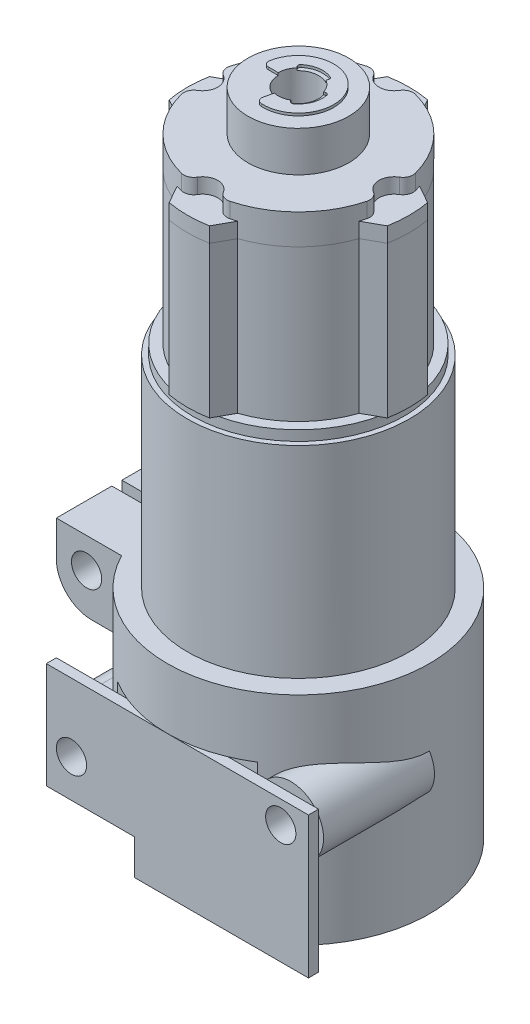
from build123d import *
from build123d.topology import SkipClean

# Parameters (mm, degrees)
CROQUIS1_R                         = 11
SALIENTE_EXTRUIR1_DEPTH            = 21
SALIENTE_EXTRUIR2_DEPTH            = 15
CORTAR_EXTRUIR1_START              = -1
CROQUIS4_R                         = 11
CROQUIS4_R_2                       = 10.5
CORTAR_EXTRUIR1_DEPTH              = 1
SALIENTE_EXTRUIR3_DEPTH            = 3
CORTAR_EXTRUIR2_DEPTH              = 1.5
CROQUIS7_R                         = 5
SALIENTE_EXTRUIR4_DEPTH            = 4
SALIENTE_EXTRUIR5_DEPTH            = 0.25
CROQUIS12_R                        = 13
SALIENTE_EXTRUIR7_DEPTH            = 21.5
CORTAR_EXTRUIR6_START              = -4.5
CORTAR_EXTRUIR6_DEPTH              = 4.5
CROQUIS15_R                        = 3.25
SALIENTE_EXTRUIR8_DEPTH            = 13
SALIENTE_EXTRUIR11_DEPTH           = 6
SALIENTE_EXTRUIR11_DEPTH_BACK      = 7.5
CROQUIS16_R                        = 1.5
CORTAR_EXTRUIR8_REACH              = 57.062
CORTAR_EXTRUIR8_END_RADIUS         = 11
CROQUIS9_R                         = 2
CORTAR_EXTRUIR5_DEPTH              = 69.214734592
CROQUIS20_W                        = 27.5
CROQUIS20_H                        = 15.5
CORTAR_EXTRUIR10_DEPTH             = 53.636133072
SALIENTE_EXTRUIR12_DEPTH           = 1
CORTAR_EXTRUIR11_DEPTH             = 8.5
CROQUIS23_R                        = 0.75
SALIENTE_EXTRUIR13_DEPTH           = 6
CORTAR_EXTRUIR12_REACH             = 50.616
CROQUIS24_W                        = 2.25
CROQUIS24_H                        = 3
CORTAR_EXTRUIR12_DIRECTION_2_REACH = 50.616
CROQUIS25_R                        = 1.5
CORTAR_EXTRUIR13_DEPTH             = 5


with BuildPart() as part:
    # Croquis1 → Saliente-Extruir1 (new body)
    with BuildSketch(Plane(origin=(0, 0, 0), x_dir=(1, 0, 0), z_dir=(0, 1, 0))):
        with Locations(Location((0, 0, 0), (0, 0, 90))):
            Circle(CROQUIS1_R)
    extrude(amount=SALIENTE_EXTRUIR1_DEPTH)

    # Croquis4 → Cortar-Extruir1 (cut)
    with BuildSketch(Plane(origin=(0, 21, 0), x_dir=(1, 0, 0), z_dir=(0, 1, 0)).offset(CORTAR_EXTRUIR1_START)):
        with Locations(Location((0, 0, 0), (0, 0, 90))):
            Circle(CROQUIS4_R)
        with Locations(Location((0, 0, 0), (0, 0, 270))):
            Circle(CROQUIS4_R_2, mode=Mode.SUBTRACT)
    extrude(amount=CORTAR_EXTRUIR1_DEPTH, mode=Mode.SUBTRACT)

    # Croquis12 → Saliente-Extruir7 (add)
    with BuildSketch(Plane.XZ):
        with Locations(Location((0, 0, 0), (0, 0, 270))):
            Circle(CROQUIS12_R)
    extrude(amount=SALIENTE_EXTRUIR7_DEPTH)

    # Croquis14 → Cortar-Extruir6 (cut)
    with BuildSketch(Plane.XZ.offset(21.5).offset(CORTAR_EXTRUIR6_START)):
        with BuildLine():
            ThreePointArc((-8.2e-08, -13), (-1.510225466, -12.911979672), (-3, -12.649110641))
            Line((-3, -12.649110641), (-3, -10.062305899))
            ThreePointArc((-3, -10.062305899), (9.459263182, -4.557668269), (6, 8.61684397))
            Line((6, 8.61684397), (6, 11.532562595))
            ThreePointArc((6, 11.532562595), (11.113055385, 6.745368782), (13, 0))
            Line((13, 0), (13, 13))
            Line((13, 13), (-13, 13))
            Line((-13, 13), (-13, -13))
            Line((-13, -13), (-8.2e-08, -13))
        make_face()
    extrude(amount=CORTAR_EXTRUIR6_DEPTH, mode=Mode.SUBTRACT)

    # Croquis15 → Saliente-Extruir8 (add, through all)
    with SkipClean():  # the faces are left unmerged after this step: merging them gives an invalid solid
        with BuildSketch(Plane.XY):
            with Locations(Location((10.25, -9.25, 0), (0, 0, 327.795772496))):
                Circle(CROQUIS15_R)
            with BuildLine():
                Line((-12, -10.5), (-3, -10.5))
                Line((-3, -10.5), (-3, -17))
                Line((-3, -17), (-14, -17))
                Line((-14, -17), (-14, -12.5))
                ThreePointArc((-14, -12.5), (-13.414213562, -11.085786438), (-12, -10.5))
            make_face()
        extrude(amount=SALIENTE_EXTRUIR8_DEPTH)

    # Croquis16 → Saliente-Extruir11 (add, two sides: drawn at the far end of the back side and taken through both)
    with SkipClean():  # the faces are left unmerged after this step: merging them gives an invalid solid
        with BuildSketch(Plane.XY.offset(-SALIENTE_EXTRUIR11_DEPTH_BACK)):
            with BuildLine():
                Line((-18, 0), (0, 0))
                Line((0, 0), (0, -7))
                Line((0, -7), (-14.5, -7))
                ThreePointArc((-14.5, -7), (-16.974873734, -5.974873734), (-18, -3.5))
                Line((-18, -3.5), (-18, 0))
            make_face()
            with Locations((-15, -3)):
                Circle(CROQUIS16_R, mode=Mode.SUBTRACT)
        extrude(amount=SALIENTE_EXTRUIR11_DEPTH + SALIENTE_EXTRUIR11_DEPTH_BACK)

    # Cortar-Extruir8: up to this cylinder (the profile starts outside it)
    with SkipClean():  # the faces are left unmerged after this step: merging them gives an invalid solid
        cortar_extruir8_end = Plane(origin=(0, -7.27151, 0), z_dir=(0, -1, 0)) * Cylinder(CORTAR_EXTRUIR8_END_RADIUS, 137.124, mode=Mode.PRIVATE)
        # Croquis19 → Cortar-Extruir8 (cut, up to the surface)
        with BuildSketch(Plane.ZY.offset(18), mode=Mode.PRIVATE) as cortar_extruir8_sk1:
            with BuildLine():
                Line((-0.5, 0), (0.5, 0))
                Line((0.5, 0), (0.5, -8))
                Line((0.5, -8), (3, -8))
                ThreePointArc((3, -8), (4, -9), (3, -10))
                Line((3, -10), (-3, -10))
                ThreePointArc((-3, -10), (-4, -9), (-3, -8))
                Line((-3, -8), (-0.5, -8))
                Line((-0.5, -8), (-0.5, 0))
            make_face()
        cortar_extruir8_tool1 = extrude(cortar_extruir8_sk1.sketch, amount=-CORTAR_EXTRUIR8_REACH, mode=Mode.PRIVATE) - cortar_extruir8_end
        add(cortar_extruir8_tool1.solids().sort_by_distance((-18, -7.27151, 0))[0], mode=Mode.SUBTRACT)


with BuildPart() as body_2:
    # Croquis2 → Saliente-Extruir2 (new body)
    with BuildSketch(Plane(origin=(0, 21, 0), x_dir=(1, 0, 0), z_dir=(0, 1, 0))):
        with BuildLine():
            Line((-2, 10.816653826), (-3, 9.013878189))
            ThreePointArc((-3, 9.013878189), (-6.717514421, 6.717514421), (-9.013878189, 3))
            Line((-9.013878189, 3), (-10.816653826, 2))
            ThreePointArc((-10.816653826, 2), (-11, 0), (-10.816653826, -2))
            Line((-10.816653826, -2), (-9.013878189, -3))
            ThreePointArc((-9.013878189, -3), (-6.717514421, -6.717514421), (-3, -9.013878189))
            Line((-3, -9.013878189), (-2, -10.816653826))
            ThreePointArc((-2, -10.816653826), (0, -11), (2, -10.816653826))
            Line((2, -10.816653826), (3, -9.013878189))
            ThreePointArc((3, -9.013878189), (6.717514421, -6.717514421), (9.013878189, -3))
            Line((9.013878189, -3), (10.816653826, -2))
            ThreePointArc((10.816653826, -2), (11, 0), (10.816653826, 2))
            Line((10.816653826, 2), (9.013878189, 3))
            ThreePointArc((9.013878189, 3), (6.717514421, 6.717514421), (3, 9.013878189))
            Line((3, 9.013878189), (2, 10.816653826))
            ThreePointArc((2, 10.816653826), (0, 11), (-2, 10.816653826))
        make_face()
    extrude(amount=SALIENTE_EXTRUIR2_DEPTH)


with BuildPart() as body_3:
    # Croquis5 → Saliente-Extruir3 (new body)
    with BuildSketch(Plane(origin=(0, 36, 0), x_dir=(1, 0, 0), z_dir=(0, 1, 0))):
        with BuildLine():
            Line((-2, 10.816653826), (-3, 9.013878189))
            ThreePointArc((-3, 9.013878189), (-6.717514421, 6.717514421), (-9.013878189, 3))
            Line((-9.013878189, 3), (-10.816653826, 2))
            ThreePointArc((-10.816653826, 2), (-11, 0), (-10.816653826, -2))
            Line((-10.816653826, -2), (-9.013878189, -3))
            ThreePointArc((-9.013878189, -3), (-6.717514421, -6.717514421), (-3, -9.013878189))
            Line((-3, -9.013878189), (-2, -10.816653826))
            ThreePointArc((-2, -10.816653826), (0, -11), (2, -10.816653826))
            Line((2, -10.816653826), (3, -9.013878189))
            ThreePointArc((3, -9.013878189), (6.717514421, -6.717514421), (9.013878189, -3))
            Line((9.013878189, -3), (10.816653826, -2))
            ThreePointArc((10.816653826, -2), (11, 0), (10.816653826, 2))
            Line((10.816653826, 2), (9.013878189, 3))
            ThreePointArc((9.013878189, 3), (6.717514421, 6.717514421), (3, 9.013878189))
            Line((3, 9.013878189), (2, 10.816653826))
            ThreePointArc((2, 10.816653826), (0, 11), (-2, 10.816653826))
        make_face()
    extrude(amount=SALIENTE_EXTRUIR3_DEPTH)

    # Croquis6 → Cortar-Extruir2 (cut)
    with BuildSketch(Plane(origin=(0, 39, 0), x_dir=(1, 0, 0), z_dir=(0, 1, 0))):
        with BuildLine():
            Line((-3, 9.013878189), (-3, 11))
            Line((-3, 11), (3, 11))
            Line((3, 11), (3, 9.013878189))
            ThreePointArc((3, 9.013878189), (2.702732204, 9.107427663), (2.402555949, 9.191176471))
            ThreePointArc((2.402555949, 9.191176471), (1.769780297, 9.148722029), (1.289793193, 8.734210526))
            ThreePointArc((1.289793193, 8.734210526), (0, 8), (-1.289793193, 8.734210526))
            ThreePointArc((-1.289793193, 8.734210526), (-1.769780297, 9.148722029), (-2.402555949, 9.191176471))
            ThreePointArc((-2.402555949, 9.191176471), (-2.702732204, 9.107427663), (-3, 9.013878189))
        make_face()
        with BuildLine():
            Line((-9.013878189, -3), (-11, -3))
            Line((-11, -3), (-11, 3))
            Line((-11, 3), (-9.013878189, 3))
            ThreePointArc((-9.013878189, 3), (-9.107427663, 2.702732204), (-9.191176471, 2.402555949))
            ThreePointArc((-9.191176471, 2.402555949), (-9.148722029, 1.769780297), (-8.734210526, 1.289793193))
            ThreePointArc((-8.734210526, 1.289793193), (-8, 0), (-8.734210526, -1.289793193))
            ThreePointArc((-8.734210526, -1.289793193), (-9.148722029, -1.769780297), (-9.191176471, -2.402555949))
            ThreePointArc((-9.191176471, -2.402555949), (-9.107427663, -2.702732204), (-9.013878189, -3))
        make_face()
        with BuildLine():
            Line((9.013878189, 3), (11, 3))
            Line((11, 3), (11, -3))
            Line((11, -3), (9.013878189, -3))
            ThreePointArc((9.013878189, -3), (9.107427663, -2.702732204), (9.191176471, -2.402555949))
            ThreePointArc((9.191176471, -2.402555949), (9.148722029, -1.769780297), (8.734210526, -1.289793193))
            ThreePointArc((8.734210526, -1.289793193), (8, 0), (8.734210526, 1.289793193))
            ThreePointArc((8.734210526, 1.289793193), (9.148722029, 1.769780297), (9.191176471, 2.402555949))
            ThreePointArc((9.191176471, 2.402555949), (9.107427663, 2.702732204), (9.013878189, 3))
        make_face()
        with BuildLine():
            Line((3, -9.013878189), (3, -11))
            Line((3, -11), (-3, -11))
            Line((-3, -11), (-3, -9.013878189))
            ThreePointArc((-3, -9.013878189), (-2.702732204, -9.107427663), (-2.402555949, -9.191176471))
            ThreePointArc((-2.402555949, -9.191176471), (-1.769780297, -9.148722029), (-1.289793193, -8.734210526))
            ThreePointArc((-1.289793193, -8.734210526), (0, -8), (1.289793193, -8.734210526))
            ThreePointArc((1.289793193, -8.734210526), (1.769780297, -9.148722029), (2.402555949, -9.191176471))
            ThreePointArc((2.402555949, -9.191176471), (2.702732204, -9.107427663), (3, -9.013878189))
        make_face()
    extrude(amount=-CORTAR_EXTRUIR2_DEPTH, mode=Mode.SUBTRACT)

    # Croquis7 → Saliente-Extruir4 (add)
    with BuildSketch(Plane(origin=(0, 39, 0), x_dir=(1, 0, 0), z_dir=(0, 1, 0))):
        with Locations(Location((0, 0, 0), (0, 0, 270))):
            Circle(CROQUIS7_R)
    extrude(amount=SALIENTE_EXTRUIR4_DEPTH)

    # Croquis8 → Saliente-Extruir5 (add)
    with BuildSketch(Plane(origin=(0, 43, 0), x_dir=(1, 0, 0), z_dir=(0, 1, 0))):
        with BuildLine():
            Line((-0.4375, -1.951561874), (-0.647071226, -2.886398938))
            ThreePointArc((-0.647071226, -2.886398938), (-0.557649237, -3.297805179), (-0.185710884, -3.495069594))
            ThreePointArc((-0.185710884, -3.495069594), (2.732186624, 2.1875), (-3.45104654, 0.583333333))
            ThreePointArc((-3.45104654, 0.583333333), (-3.339921199, 0.177251388), (-2.958039892, 0))
            Line((-2.958039892, 0), (-2, 0))
            ThreePointArc((-2, 0), (-1.863156505, 0.727081728), (-1.47135216, 1.354667051))
            Line((-1.47135216, 1.354667051), (-1.570974215, 1.446388611))
            ThreePointArc((-1.570974215, 1.446388611), (-1.651604687, 1.634558733), (-1.564622326, 1.819878286))
            ThreePointArc((-1.564622326, 1.819878286), (-0.362288406, 2.372498074), (0.95017839, 2.203896782))
            ThreePointArc((0.95017839, 2.203896782), (1.088504765, 2.052982629), (1.067707825, 1.849324201))
            Line((1.067707825, 1.849324201), (1, 1.732050808))
            ThreePointArc((1, 1.732050808), (1.5612495, 1.25), (1.90885216, 0.596894823))
            Line((1.90885216, 0.596894823), (2.038096389, 0.637309273))
            ThreePointArc((2.038096389, 0.637309273), (2.241371731, 0.61305225), (2.358371991, 0.445063539))
            ThreePointArc((2.358371991, 0.445063539), (2.235787805, -0.872498074), (1.433541406, -1.924827015))
            ThreePointArc((1.433541406, -1.924827015), (1.233682727, -1.969164093), (1.067707825, -1.849324201))
            Line((1.067707825, -1.849324201), (1, -1.732050808))
            ThreePointArc((1, -1.732050808), (0.301907005, -1.977081728), (-0.4375, -1.951561874))
        make_face()
    extrude(amount=SALIENTE_EXTRUIR5_DEPTH)


with BuildPart() as cortar_extruir5_tool:
    # Croquis9 → Cortar-Extruir5 (new, through all)
    with SkipClean():  # the faces are left unmerged after this step: merging them gives an invalid solid
        with BuildSketch(Plane(origin=(0, 43, 0), x_dir=(1, 0, 0), z_dir=(0, 1, 0))):
            with Locations(Location((0, 0, 0), (0, 0, 60))):
                Circle(CROQUIS9_R)
        extrude(amount=-CORTAR_EXTRUIR5_DEPTH)


with BuildPart() as part_1:
    with SkipClean():  # the faces are left unmerged after this step: merging them gives an invalid solid
        add(part.part)

        # Cortar-Extruir5: cut by cortar_extruir5_tool
        add(cortar_extruir5_tool.part, mode=Mode.SUBTRACT)

    # Croquis20 → Cortar-Extruir10 (cut, through all)
    with SkipClean():  # the faces are left unmerged after this step: merging them gives an invalid solid
        with BuildSketch(Plane.XY.offset(11)):
            with Locations((-0.25, -13.75)):
                Rectangle(CROQUIS20_W, CROQUIS20_H)
        extrude(amount=CORTAR_EXTRUIR10_DEPTH, mode=Mode.SUBTRACT)

    # Croquis21 → Saliente-Extruir12 (add)
    with SkipClean():  # the faces are left unmerged after this step: merging them gives an invalid solid
        with BuildSketch(Plane.XY.offset(11)):
            Polygon((-13, -7), (13, -7), (13, -21), (-4.25, -21), (-4.25, -17.5), (-13, -17.5), align=None)
        extrude(amount=SALIENTE_EXTRUIR12_DEPTH)

    # Croquis22 → Cortar-Extruir11 (cut)
    with SkipClean():  # the faces are left unmerged after this step: merging them gives an invalid solid
        with BuildSketch(Plane.XZ.offset(21.5)):
            with BuildLine():
                Line((6, 11), (-4.25, 11))
                Line((-4.25, 11), (-4.25, 9.601432185))
                ThreePointArc((-4.25, 9.601432185), (-1.003981319, -10.45189081), (6, 8.61684397))
                Line((6, 8.61684397), (6, 11))
            make_face()
        extrude(amount=-CORTAR_EXTRUIR11_DEPTH, mode=Mode.SUBTRACT)

    # Croquis23 → Saliente-Extruir13 (add)
    # profile 1 of 2: a face of its own
    with SkipClean():  # the faces are left unmerged after this step: merging them gives an invalid solid
        with BuildSketch(Plane.XZ.offset(14)):
            Polygon((-3.75, 7), (-2.75, 6), (0.25, 6), (0.25, 11), (-3.75, 11), align=None)
            with Locations(Location((-1.75, 10, 0), (0, 0, 270))):
                Circle(CROQUIS23_R, mode=Mode.SUBTRACT)
        # profile 2 of 2: a face of its own
        with BuildSketch(Plane.XZ.offset(14)):
            Polygon((1.5, 7), (2.5, 6), (5.5, 6), (5.5, 11), (1.5, 11), align=None)
            with Locations(Location((3.5, 10, 0), (0, 0, 270))):
                Circle(CROQUIS23_R, mode=Mode.SUBTRACT)
        extrude(amount=SALIENTE_EXTRUIR13_DEPTH)

    # Croquis24 → Cortar-Extruir12 (cut, up to next)
    with BuildSketch(Plane(origin=(0, 0, 0), x_dir=(0, 0, -1), z_dir=(1, 0, 0)), mode=Mode.PRIVATE) as cortar_extruir12_sk1:
        with Locations((-7.125, -17)):
            Rectangle(CROQUIS24_W, CROQUIS24_H)
    cortar_extruir12_tool1 = extrude(cortar_extruir12_sk1.sketch, amount=-CORTAR_EXTRUIR12_REACH, mode=Mode.PRIVATE) & part_1.part
    add(cortar_extruir12_tool1.solids().sort_by_distance((0, -17, 7.125))[0], mode=Mode.SUBTRACT)

    # Cortar-Extruir12 direction 2: up to this face of the body (flat: up to its plane)
    cortar_extruir12_direction_2_end = Plane(part_1.part.faces().sort_by_distance((5.5, -17, 8.5))[0])
    # Croquis24 → Cortar-Extruir12 direction 2 (cut, up to the picked face)
    with BuildSketch(Plane(origin=(0, 0, 0), x_dir=(0, 0, -1), z_dir=(1, 0, 0)), mode=Mode.PRIVATE) as cortar_extruir12_direction_2_sk1:
        with Locations((-7.125, -17)):
            Rectangle(CROQUIS24_W, CROQUIS24_H)
    cortar_extruir12_direction_2_tool1 = split(extrude(cortar_extruir12_direction_2_sk1.sketch, amount=CORTAR_EXTRUIR12_DIRECTION_2_REACH, mode=Mode.PRIVATE), bisect_by=cortar_extruir12_direction_2_end, keep=Keep.BOTH, mode=Mode.PRIVATE)
    add(cortar_extruir12_direction_2_tool1.solids().sort_by(Axis((0, -17, 7.125), (1, 0, 0)))[0], mode=Mode.SUBTRACT)

    # Croquis25 → Cortar-Extruir13 (cut)
    with SkipClean():  # the faces are left unmerged after this step: merging them gives an invalid solid
        with BuildSketch(Plane.XY.offset(12)):
            with Locations((10.25, -9.25)):
                Circle(CROQUIS25_R)
            with Locations((-10.5, -13.75)):
                Circle(CROQUIS25_R)
        extrude(amount=-CORTAR_EXTRUIR13_DEPTH, mode=Mode.SUBTRACT)


with BuildPart() as body_2_1:
    with SkipClean():  # the faces are left unmerged after this step: merging them gives an invalid solid
        add(body_2.part)

        # Cortar-Extruir5: cut by cortar_extruir5_tool
        add(cortar_extruir5_tool.part, mode=Mode.SUBTRACT)


with BuildPart() as body_3_1:
    with SkipClean():  # the faces are left unmerged after this step: merging them gives an invalid solid
        add(body_3.part)

        # Cortar-Extruir5: cut by cortar_extruir5_tool
        add(cortar_extruir5_tool.part, mode=Mode.SUBTRACT)


solid = Compound([part_1.part, body_2_1.part, body_3_1.part])
